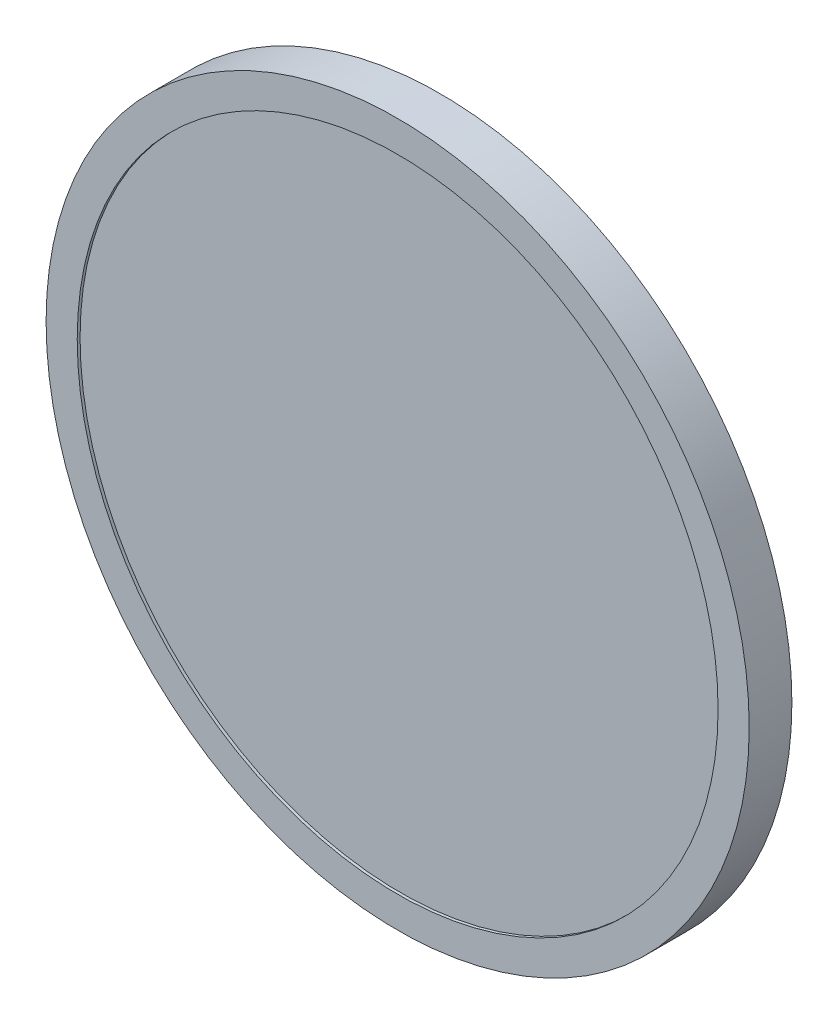
from build123d import *

# Parameters (mm, degrees)
SKETCH1_R           = 31.369
BOSS_EXTRUDE1_DEPTH = 3.81
SKETCH2_R           = 28.591620057
CUT_EXTRUDE2_DEPTH  = 0.254


with BuildPart() as part:
    # Sketch1 → Boss-Extrude1 (new body)
    with BuildSketch(Plane.XY):
        with Locations(Location((0, 0, 0), (0, 0, 180))):
            Circle(SKETCH1_R)
    extrude(amount=BOSS_EXTRUDE1_DEPTH)

    # Sketch2 → Cut-Extrude2 (cut)
    with BuildSketch(Plane.XY.offset(3.81)):
        Circle(SKETCH2_R)
    extrude(amount=-CUT_EXTRUDE2_DEPTH, mode=Mode.SUBTRACT)


solid = part.part
